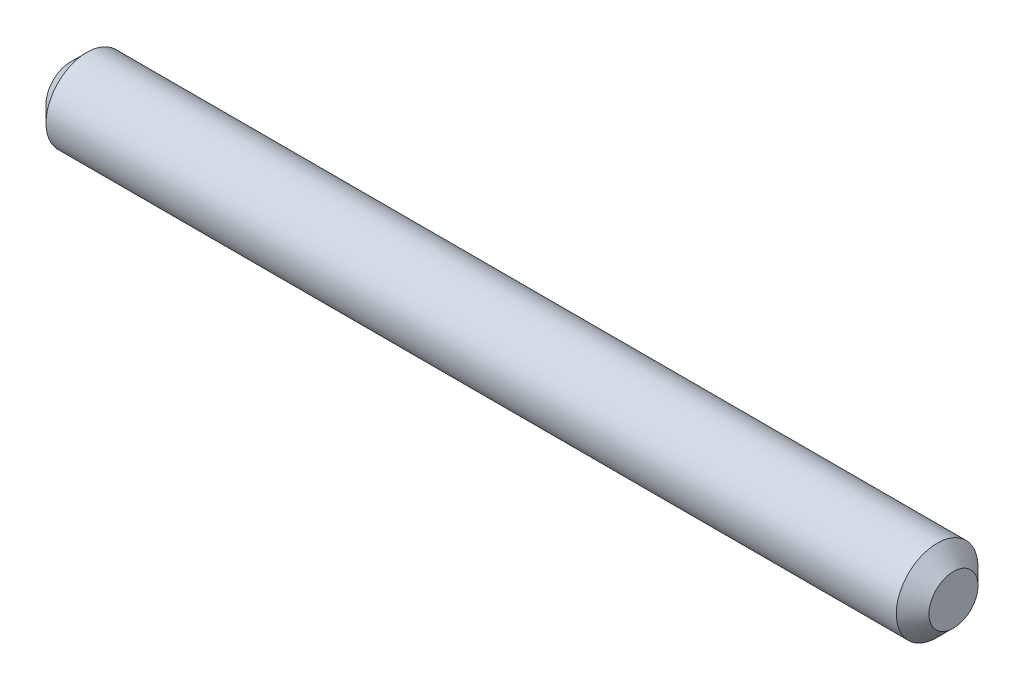
from build123d import *


with BuildPart() as part:
    # Sketch1 → Revolve1 (revolve)
    with BuildSketch(Plane.XY, mode=Mode.PRIVATE) as revolve1_sk:
        Polygon((-11.175247786, 0), (-11.175247786, 1.5), (-10.175247786, 2.5), (41.824752214, 2.5), (42.824752214, 1.5), (42.824752214, 0), align=None)
    revolve(revolve1_sk.sketch.rotate(Axis((-26.082337868, 0, 0), (1, 0, 0)), 90), axis=Axis((-26.082337868, 0, 0), (1, 0, 0)))


solid = part.part
